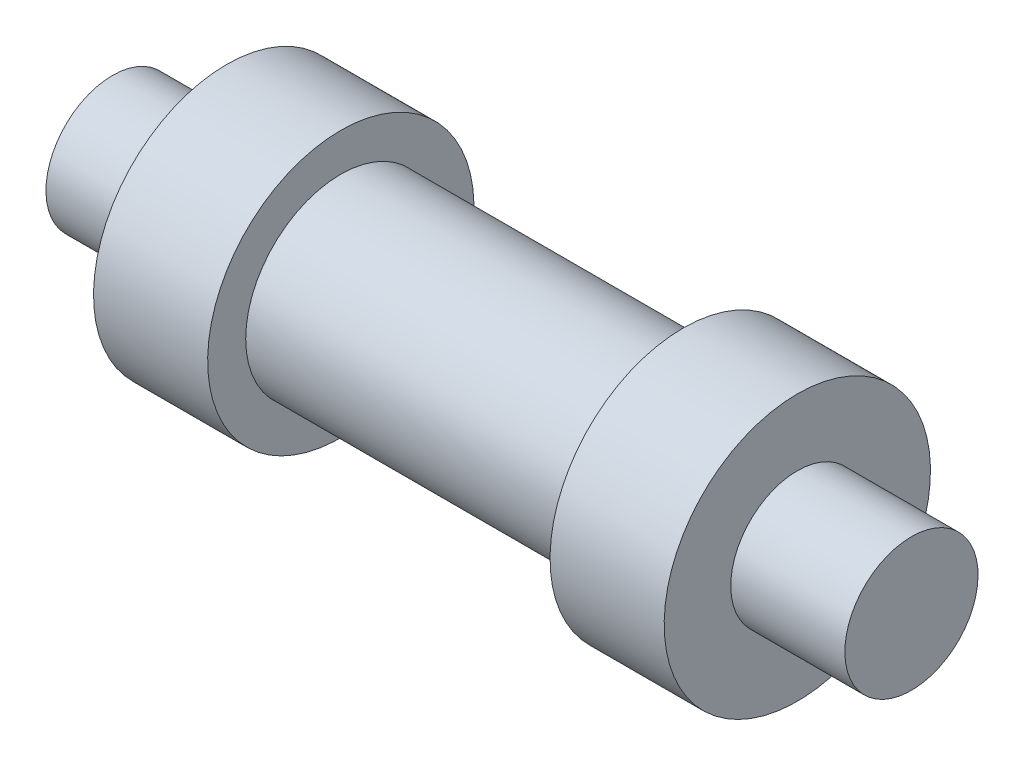
from build123d import *


with BuildPart() as part:
    # Sketch1 → Revolve1 (revolve)
    with BuildSketch(Plane.XY):
        Polygon((0, 0), (0, 3.5), (6, 3.5), (6, 7), (12, 7), (12, 5), (30, 5), (30, 7), (36, 7), (36, 3.5), (42, 3.5), (42, 0), align=None)
    revolve(axis=Axis((42, 0, 0), (-1, 0, 0)))


solid = part.part
